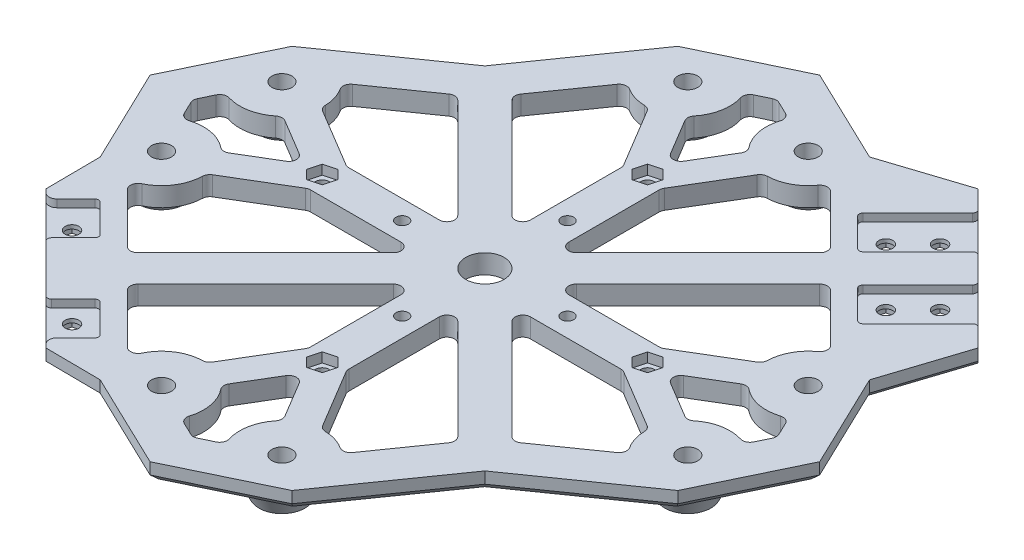
from build123d import *

# Parameters (mm, degrees)
SKETCH1_R           = 2.6
BOSS_EXTRUDE1_DEPTH = 5
CIRPATTERN1_COUNT   = 4
CHAMFER2_SIZE       = 2
SKETCH5_R           = 1.6
CUT_EXTRUDE1_DEPTH  = 124.632678371
CUT_EXTRUDE2_DEPTH  = 2.5
SKETCH8_R           = 1.8
CUT_EXTRUDE3_DEPTH  = 124.858948652
CUT_EXTRUDE4_DEPTH  = 2
CUT_EXTRUDE5_DEPTH  = 2
FILLET1_R           = 1
FILLET2_R           = 2
SKETCH13_R          = 1.8
CUT_EXTRUDE7_DEPTH  = 124.858948652
CUT_EXTRUDE8_DEPTH  = 2.5
SKETCH15_R          = 5
CUT_EXTRUDE9_DEPTH  = 124.858948652


with BuildPart() as part:
    # Sketch1 → Boss-Extrude1 (new body)
    with BuildSketch(Plane(origin=(0, 0, 0), x_dir=(1, 0, 0), z_dir=(0, 1, 0))):
        Polygon((-25.000397559, 75.352774368), (0, 87.349983289), (25.000397559, 75.352774368), (46.347249987, 82.303629811), (82.303629811, 46.347249987), (75.352774368, 25.000397559), (87.349983289, 0), (75.352774368, -25.000397559), (45.752697693, -45.752697693), (25.000397559, -75.352774368), (0, -87.349983289), (-25.000397559, -75.352774368), (-39.269463863, -75.225843687), (-75.225843687, -39.269463863), (-75.352774368, -25.000397559), (-87.349983289, 0), (-75.352774368, 25.000397559), (-45.752697693, 45.752697693), align=None)
        with Locations((-15.705, 68.65)):
            Circle(SKETCH1_R, mode=Mode.SUBTRACT)
        with Locations((15.705, 68.65)):
            Circle(SKETCH1_R, mode=Mode.SUBTRACT)
        with Locations((68.65, 15.705)):
            Circle(SKETCH1_R, mode=Mode.SUBTRACT)
        with Locations((68.65, -15.705)):
            Circle(SKETCH1_R, mode=Mode.SUBTRACT)
        with Locations((15.705, -68.65)):
            Circle(SKETCH1_R, mode=Mode.SUBTRACT)
        with Locations((-15.705, -68.65)):
            Circle(SKETCH1_R, mode=Mode.SUBTRACT)
        with Locations((-68.65, -15.705)):
            Circle(SKETCH1_R, mode=Mode.SUBTRACT)
        with Locations((-68.65, 15.705)):
            Circle(SKETCH1_R, mode=Mode.SUBTRACT)
    extrude(amount=BOSS_EXTRUDE1_DEPTH)

    # Sketch4 → Revolve1 (revolve)
    with BuildSketch(Plane(origin=(14.012041645, 0, -6.724108712), x_dir=(0, -1, 0), z_dir=(0.901565003925945, 0, -0.432643668272183))):
        Polygon((0, 73.18710633), (4, 73.18710633), (4, 74.68710633), (0, 76.68710633), align=None)
    revolve1 = revolve(axis=Axis((-15.705, 5, -68.65), (0, -1, 0)))

    # Mirror1: Revolve1 across plane
    add(revolve1.mirror(Plane(origin=(0, 0, 0), x_dir=(0, 0, 1), z_dir=(1, 0, 0))))

    # CirPattern1: Revolve1 ×4 about axis
    cirpattern1_axis = Axis((0, 0, 0), (0, -1, 0))
    for i in range(1, CIRPATTERN1_COUNT):
        add(revolve1.rotate(cirpattern1_axis, i * 360 / CIRPATTERN1_COUNT))

    # CirPattern1 copy 1 sketch → CirPattern1 copy 1 (revolve)
    with BuildSketch(Plane(origin=(6.724108712, 0, -14.012041645), x_dir=(0, -1, 0), z_dir=(0.4326436682721619, 0, -0.9015650039259551))):
        Polygon((0, -73.18710633), (4, -73.18710633), (4, -74.68710633), (0, -76.68710633), align=None)
    revolve(axis=Axis((68.65, 5, 15.705), (0, 1, 0)))

    # CirPattern1 copy 2 sketch → CirPattern1 copy 2 (revolve)
    with BuildSketch(Plane(origin=(14.012041645, 0, 6.724108712), x_dir=(0, -1, 0), z_dir=(0.9015650039259551, 0, 0.43264366827216183))):
        Polygon((0, -73.18710633), (4, -73.18710633), (4, -74.68710633), (0, -76.68710633), align=None)
    revolve(axis=Axis((-15.705, 5, 68.65), (0, 1, 0)))

    # CirPattern1 copy 3 sketch → CirPattern1 copy 3 (revolve)
    with BuildSketch(Plane(origin=(-6.724108712, 0, 14.012041645), x_dir=(0, -1, 0), z_dir=(-0.4326436682721618, 0, 0.9015650039259552))):
        Polygon((0, -73.18710633), (4, -73.18710633), (4, -74.68710633), (0, -76.68710633), align=None)
    revolve(axis=Axis((-68.65, 5, -15.705), (0, 1, 0)))

    # Chamfer2
    chamfer2_edges = [part.edges().sort_by_distance(p)[0] for p in [
        (-32.134930711, 0, 75.289309027),
        (-12.500198779, 0, 81.351378828),
        (12.500198779, 0, 81.351378828),
        (35.376547626, 0, 60.55273603),
        (60.55273603, 0, 35.376547626),
        (81.351378828, 0, 12.500198779),
        (81.351378828, 0, -12.500198779),
        (78.828202089, 0, -35.673823773),
        (35.673823773, 0, -78.828202089),
        (12.500198779, 0, -81.351378828),
        (-12.500198779, 0, -81.351378828),
        (-35.376547626, 0, -60.55273603),
        (-60.55273603, 0, -35.376547626),
        (-81.351378828, 0, -12.500198779),
        (-81.351378828, 0, 12.500198779),
        (-75.289309027, 0, 32.134930711),
    ]]
    chamfer(chamfer2_edges, length=CHAMFER2_SIZE)

    # Sketch5 → Cut-Extrude1 (cut, through all)
    with BuildSketch(Plane.XZ):
        with Locations((0, 21.566756826)):
            Circle(SKETCH5_R)
        with Locations((-21.566756826, 0)):
            Circle(SKETCH5_R)
        with Locations((0, -21.566756826)):
            Circle(SKETCH5_R)
        with Locations((21.566756826, 0)):
            Circle(SKETCH5_R)
    extrude(amount=-CUT_EXTRUDE1_DEPTH, mode=Mode.SUBTRACT)

    # Sketch6 → Cut-Extrude2 (cut)
    with BuildSketch(Plane.XZ):
        Polygon((2.041241452, 23.607998279), (-0.747146227, 24.355144505), (-2.788387679, 22.313903053), (-2.041241452, 19.525515374), (0.747146227, 18.778369147), (2.788387679, 20.819610599), align=None)
        Polygon((23.607998279, 2.041241452), (20.819610599, 2.788387679), (18.778369147, 0.747146227), (19.525515374, -2.041241452), (22.313903053, -2.788387679), (24.355144505, -0.747146227), align=None)
        Polygon((-19.525515374, 2.041241452), (-22.313903053, 2.788387679), (-24.355144505, 0.747146227), (-23.607998279, -2.041241452), (-20.819610599, -2.788387679), (-18.778369147, -0.747146227), align=None)
        Polygon((-0.747146227, -18.778369147), (-2.788387679, -20.819610599), (-2.041241452, -23.607998279), (0.747146227, -24.355144505), (2.788387679, -22.313903053), (2.041241452, -19.525515374), align=None)
    extrude(amount=-CUT_EXTRUDE2_DEPTH, mode=Mode.SUBTRACT)

    # Sketch8 → Cut-Extrude3 (cut, through all)
    with BuildSketch(Plane(origin=(0, 5, 0), x_dir=(1, 0, 0), z_dir=(0, 1, 0))):
        with Locations((-64.460142943, -43.246939508)):
            Circle(SKETCH8_R)
        with Locations((-43.246939508, -64.460142943)):
            Circle(SKETCH8_R)
        with Locations((51.951071228, 66.800313633)):
            Circle(SKETCH8_R)
        with Locations((44.880003416, 59.729245821)):
            Circle(SKETCH8_R)
        with Locations((66.800313633, 51.951071228)):
            Circle(SKETCH8_R)
        with Locations((59.729245821, 44.880003416)):
            Circle(SKETCH8_R)
    extrude(amount=-CUT_EXTRUDE3_DEPTH, mode=Mode.SUBTRACT)

    # Sketch9 → Cut-Extrude4 (cut)
    with BuildSketch(Plane(origin=(0, 5, 0), x_dir=(1, 0, 0), z_dir=(0, 1, 0))):
        Polygon((-72.945424317, -41.549883233), (-65.874356506, -34.478815421), (-57.106232419, -43.246939508), (-64.177300231, -50.318007319), align=None)
        Polygon((-50.318007319, -64.177300231), (-43.246939508, -57.106232419), (-34.478815421, -65.874356506), (-41.549883233, -72.945424317), align=None)
        Polygon((51.809649872, 76.841229926), (36.11187933, 61.143459384), (44.880003416, 52.375335297), (60.577773959, 68.073105839), align=None)
        Polygon((68.073105839, 60.577773959), (52.375335297, 44.880003416), (61.143459384, 36.11187933), (76.841229926, 51.809649872), align=None)
    extrude(amount=-CUT_EXTRUDE4_DEPTH, mode=Mode.SUBTRACT)

    # Sketch11 → Cut-Extrude5 (cut)
    with BuildSketch(Plane.XZ):
        Polygon((-40.899511837, 66.807570613), (-44.106157668, 67.666788774), (-46.453585339, 65.319361104), (-45.594367178, 62.112715273), (-42.387721347, 61.253497112), (-40.040293677, 63.600924782), align=None)
        Polygon((-65.319361104, 46.453585339), (-67.666788774, 44.106157668), (-66.807570613, 40.899511837), (-63.600924782, 40.040293677), (-61.253497112, 42.387721347), (-62.112715273, 45.594367178), align=None)
        Polygon((62.076673492, -42.532575746), (58.870027661, -41.673357585), (56.52259999, -44.020785256), (57.381818151, -47.227431087), (60.588463982, -48.086649247), (62.935891652, -45.739221577), align=None)
        Polygon((69.147741303, -49.603643558), (65.941095472, -48.744425397), (63.593667802, -51.091853068), (64.452885963, -54.298498899), (67.659531794, -55.157717059), (70.006959464, -52.810289389), align=None)
        Polygon((54.298498899, -64.452885963), (51.091853068, -63.593667802), (48.744425397, -65.941095472), (49.603643558, -69.147741303), (52.810289389, -70.006959464), (55.157717059, -67.659531794), align=None)
        Polygon((47.227431087, -57.381818151), (44.020785256, -56.52259999), (41.673357585, -58.870027661), (42.532575746, -62.076673492), (45.739221577, -62.935891652), (48.086649247, -60.588463982), align=None)
    extrude(amount=-CUT_EXTRUDE5_DEPTH, mode=Mode.SUBTRACT)

    # Fillet1
    fillet1_edges = [part.edges().sort_by_distance(p)[0] for p in [
        (-43.246939508, 4, 57.106232419),
        (-50.318007319, 4, 64.177300231),
        (-34.478815421, 4, 65.874356506),
        (-57.106232419, 4, 43.246939508),
        (-64.177300231, 4, 50.318007319),
        (-65.874356506, 4, 34.478815421),
        (60.577773959, 4, -68.073105839),
        (44.880003416, 4, -52.375335297),
        (76.841229926, 4, -51.809649872),
        (61.143459384, 4, -36.11187933),
        (68.073105839, 4, -60.577773959),
        (52.375335297, 4, -44.880003416),
        (51.809649872, 4, -76.841229926),
        (36.11187933, 4, -61.143459384),
    ]]
    fillet(fillet1_edges, radius=FILLET1_R)

    # Fillet2
    fillet2_edges = [part.edges().sort_by_distance(p)[0] for p in [
        (-41.549883233, 4, 72.945424317),
        (-72.945424317, 4, 41.549883233),
    ]]
    fillet(fillet2_edges, radius=FILLET2_R)

    # Sketch13 → Cut-Extrude7 (cut, through all)
    with BuildSketch(Plane(origin=(0, 5, 0), x_dir=(1, 0, 0), z_dir=(0, 1, 0))):
        with Locations((0, 42.426406871)):
            Circle(SKETCH13_R)
        with Locations((42.426406871, 0)):
            Circle(SKETCH13_R)
        with Locations((0, -42.426406871)):
            Circle(SKETCH13_R)
        with Locations((-42.426406871, 0)):
            Circle(SKETCH13_R)
    extrude(amount=-CUT_EXTRUDE7_DEPTH, mode=Mode.SUBTRACT)

    # Sketch14 → Cut-Extrude8 (cut)
    with BuildSketch(Plane(origin=(0, 5, 0), x_dir=(1, 0, 0), z_dir=(0, 1, 0))):
        Polygon((3.206645831, 43.285625032), (0.859218161, 45.633052702), (-2.34742767, 44.773834541), (-3.206645831, 41.56718871), (-0.859218161, 39.21976104), (2.34742767, 40.078979201), align=None)
        Polygon((43.285625032, 3.206645831), (40.078979201, 2.34742767), (39.21976104, -0.859218161), (41.56718871, -3.206645831), (44.773834541, -2.34742767), (45.633052702, 0.859218161), align=None)
        Polygon((0.859218161, -39.21976104), (-2.34742767, -40.078979201), (-3.206645831, -43.285625032), (-0.859218161, -45.633052702), (2.34742767, -44.773834541), (3.206645831, -41.56718871), align=None)
        Polygon((-39.21976104, 0.859218161), (-41.56718871, 3.206645831), (-44.773834541, 2.34742767), (-45.633052702, -0.859218161), (-43.285625032, -3.206645831), (-40.078979201, -2.34742767), align=None)
    extrude(amount=-CUT_EXTRUDE8_DEPTH, mode=Mode.SUBTRACT)

    # Sketch15 → Cut-Extrude9 (cut, through all)
    with BuildSketch(Plane(origin=(0, 5, 0), x_dir=(1, 0, 0), z_dir=(0, 1, 0))):
        Circle(SKETCH15_R)
        with BuildLine():
            Line((-58.852206169, 24.355964891), (-44.105038963, 34.695047569))
            ThreePointArc((-44.105038963, 34.695047569), (-42.783195007, 35.049863165), (-41.542703678, 34.471635866))
            Line((-41.542703678, 34.471635866), (-15.485281374, 8.414213562))
            ThreePointArc((-15.485281374, 8.414213562), (-15.051735872, 6.234633135), (-16.899494937, 5))
            Line((-16.899494937, 5), (-40.490601096, 5))
            ThreePointArc((-40.490601096, 5), (-41.023679978, 5.072351976), (-41.51818955, 5.284173095))
            Line((-41.51818955, 5.284173095), (-56.683057857, 14.366233497))
            ThreePointArc((-56.683057857, 14.366233497), (-57.380980681, 15.070818182), (-57.654627956, 16.024051109))
            ThreePointArc((-57.654627956, 16.024051109), (-58.139410466, 18.949612097), (-59.388071455, 21.639364299))
            ThreePointArc((-59.388071455, 21.639364299), (-59.666274463, 23.105393032), (-58.852206169, 24.355964891))
        make_face()
        with BuildLine():
            Line((-74.269911641, 4.143212944), (-75.84292496, 0.865287337))
            ThreePointArc((-75.84292496, 0.865287337), (-76.039794952, 0), (-75.84292496, -0.865287337))
            Line((-75.84292496, -0.865287337), (-74.269911641, -4.143212944))
            ThreePointArc((-74.269911641, -4.143212944), (-73.268935292, -5.110014444), (-71.879584459, -5.189783206))
            ThreePointArc((-71.879584459, -5.189783206), (-66.573971622, -4.902680519), (-61.752741768, -7.135996039))
            ThreePointArc((-61.752741768, -7.135996039), (-60.636709812, -7.573227602), (-59.471106362, -7.293822224))
            Line((-59.471106362, -7.293822224), (-50.157188519, -1.715826905))
            ThreePointArc((-50.157188519, -1.715826905), (-49.184776974, 0), (-50.157188519, 1.715826905))
            Line((-50.157188519, 1.715826905), (-59.471106362, 7.293822224))
            ThreePointArc((-59.471106362, 7.293822224), (-60.636709812, 7.573227602), (-61.752741768, 7.135996039))
            ThreePointArc((-61.752741768, 7.135996039), (-66.573971622, 4.902680519), (-71.879584459, 5.189783206))
            ThreePointArc((-71.879584459, 5.189783206), (-73.268935292, 5.110014444), (-74.269911641, 4.143212944))
        make_face()
        with BuildLine():
            Line((-34.695047569, 44.105038963), (-24.355964891, 58.852206169))
            ThreePointArc((-24.355964891, 58.852206169), (-23.105393032, 59.666274463), (-21.639364299, 59.388071455))
            ThreePointArc((-21.639364299, 59.388071455), (-18.949612097, 58.139410466), (-16.024051109, 57.654627956))
            ThreePointArc((-16.024051109, 57.654627956), (-15.070818182, 57.380980681), (-14.366233497, 56.683057857))
            Line((-14.366233497, 56.683057857), (-5.284173095, 41.51818955))
            ThreePointArc((-5.284173095, 41.51818955), (-5.072351976, 41.023679978), (-5, 40.490601096))
            Line((-5, 40.490601096), (-5, 16.899494937))
            ThreePointArc((-5, 16.899494937), (-6.234633135, 15.051735872), (-8.414213562, 15.485281374))
            Line((-8.414213562, 15.485281374), (-34.471635866, 41.542703678))
            ThreePointArc((-34.471635866, 41.542703678), (-35.049863165, 42.783195007), (-34.695047569, 44.105038963))
        make_face()
        with BuildLine():
            Line((-4.143212944, 74.269911641), (-0.865287337, 75.84292496))
            ThreePointArc((-0.865287337, 75.84292496), (0, 76.039794952), (0.865287337, 75.84292496))
            Line((0.865287337, 75.84292496), (4.143212944, 74.269911641))
            ThreePointArc((4.143212944, 74.269911641), (5.110014444, 73.268935292), (5.189783206, 71.879584459))
            ThreePointArc((5.189783206, 71.879584459), (4.902680519, 66.573971622), (7.135996039, 61.752741768))
            ThreePointArc((7.135996039, 61.752741768), (7.573227602, 60.636709812), (7.293822224, 59.471106362))
            Line((7.293822224, 59.471106362), (1.715826905, 50.157188519))
            ThreePointArc((1.715826905, 50.157188519), (0, 49.184776974), (-1.715826905, 50.157188519))
            Line((-1.715826905, 50.157188519), (-7.293822224, 59.471106362))
            ThreePointArc((-7.293822224, 59.471106362), (-7.573227602, 60.636709812), (-7.135996039, 61.752741768))
            ThreePointArc((-7.135996039, 61.752741768), (-4.902680519, 66.573971622), (-5.189783206, 71.879584459))
            ThreePointArc((-5.189783206, 71.879584459), (-5.110014444, 73.268935292), (-4.143212944, 74.269911641))
        make_face()
        with BuildLine():
            Line((-56.683057857, -14.366233497), (-41.51818955, -5.284173095))
            ThreePointArc((-41.51818955, -5.284173095), (-41.023679978, -5.072351976), (-40.490601096, -5))
            Line((-40.490601096, -5), (-16.899494937, -5))
            ThreePointArc((-16.899494937, -5), (-15.051735872, -6.234633135), (-15.485281374, -8.414213562))
            Line((-15.485281374, -8.414213562), (-48.762372401, -41.691304589))
            ThreePointArc((-48.762372401, -41.691304589), (-50.176585963, -42.277091027), (-51.590799526, -41.691304589))
            Line((-51.590799526, -41.691304589), (-64.441670212, -28.840433903))
            ThreePointArc((-64.441670212, -28.840433903), (-64.998941561, -27.089698063), (-63.892463319, -25.622955673))
            ThreePointArc((-63.892463319, -25.622955673), (-59.426482475, -21.698890595), (-57.654627956, -16.024051109))
            ThreePointArc((-57.654627956, -16.024051109), (-57.380980681, -15.070818182), (-56.683057857, -14.366233497))
        make_face()
        with BuildLine():
            Line((5, 40.490601096), (5, 16.899494937))
            ThreePointArc((5, 16.899494937), (6.234633135, 15.051735872), (8.414213562, 15.485281374))
            Line((8.414213562, 15.485281374), (40.142387983, 47.213455794))
            ThreePointArc((40.142387983, 47.213455794), (40.72817442, 48.627669357), (40.142387983, 50.041882919))
            Line((40.142387983, 50.041882919), (27.688744236, 62.495526666))
            ThreePointArc((27.688744236, 62.495526666), (26.110756271, 63.074596311), (24.648449032, 62.245726472))
            ThreePointArc((24.648449032, 62.245726472), (20.873948018, 58.940109352), (16.024051109, 57.654627956))
            ThreePointArc((16.024051109, 57.654627956), (15.070818182, 57.380980681), (14.366233497, 56.683057857))
            Line((14.366233497, 56.683057857), (5.284173095, 41.51818955))
            ThreePointArc((5.284173095, 41.51818955), (5.072351976, 41.023679978), (5, 40.490601096))
        make_face()
        with BuildLine():
            Line((40.490601096, 5), (16.899494937, 5))
            ThreePointArc((16.899494937, 5), (15.051735872, 6.234633135), (15.485281374, 8.414213562))
            Line((15.485281374, 8.414213562), (47.213455794, 40.142387983))
            ThreePointArc((47.213455794, 40.142387983), (48.627669357, 40.72817442), (50.041882919, 40.142387983))
            Line((50.041882919, 40.142387983), (62.495526666, 27.688744236))
            ThreePointArc((62.495526666, 27.688744236), (63.074596311, 26.110756271), (62.245726472, 24.648449032))
            ThreePointArc((62.245726472, 24.648449032), (58.940109352, 20.873948018), (57.654627956, 16.024051109))
            ThreePointArc((57.654627956, 16.024051109), (57.380980681, 15.070818182), (56.683057857, 14.366233497))
            Line((56.683057857, 14.366233497), (41.51818955, 5.284173095))
            ThreePointArc((41.51818955, 5.284173095), (41.023679978, 5.072351976), (40.490601096, 5))
        make_face()
        with BuildLine():
            Line((59.471106362, -7.293822224), (50.157188519, -1.715826905))
            ThreePointArc((50.157188519, -1.715826905), (49.184776974, 0), (50.157188519, 1.715826905))
            Line((50.157188519, 1.715826905), (59.471106362, 7.293822224))
            ThreePointArc((59.471106362, 7.293822224), (60.636709812, 7.573227602), (61.752741768, 7.135996039))
            ThreePointArc((61.752741768, 7.135996039), (66.573971622, 4.902680519), (71.879584459, 5.189783206))
            ThreePointArc((71.879584459, 5.189783206), (73.268935292, 5.110014444), (74.269911641, 4.143212944))
            Line((74.269911641, 4.143212944), (75.84292496, 0.865287337))
            ThreePointArc((75.84292496, 0.865287337), (76.039794952, 0), (75.84292496, -0.865287337))
            Line((75.84292496, -0.865287337), (74.269911641, -4.143212944))
            ThreePointArc((74.269911641, -4.143212944), (73.268935292, -5.110014444), (71.879584459, -5.189783206))
            ThreePointArc((71.879584459, -5.189783206), (66.573971622, -4.902680519), (61.752741768, -7.135996039))
            ThreePointArc((61.752741768, -7.135996039), (60.636709812, -7.573227602), (59.471106362, -7.293822224))
        make_face()
        with BuildLine():
            Line((44.105038963, -34.695047569), (58.852206169, -24.355964891))
            ThreePointArc((58.852206169, -24.355964891), (59.666274463, -23.105393032), (59.388071455, -21.639364299))
            ThreePointArc((59.388071455, -21.639364299), (58.139410466, -18.949612097), (57.654627956, -16.024051109))
            ThreePointArc((57.654627956, -16.024051109), (57.380980681, -15.070818182), (56.683057857, -14.366233497))
            Line((56.683057857, -14.366233497), (41.51818955, -5.284173095))
            ThreePointArc((41.51818955, -5.284173095), (41.023679978, -5.072351976), (40.490601096, -5))
            Line((40.490601096, -5), (16.899494937, -5))
            ThreePointArc((16.899494937, -5), (15.051735872, -6.234633135), (15.485281374, -8.414213562))
            Line((15.485281374, -8.414213562), (41.542703678, -34.471635866))
            ThreePointArc((41.542703678, -34.471635866), (42.783195007, -35.049863165), (44.105038963, -34.695047569))
        make_face()
        with BuildLine():
            Line((24.355964891, -58.852206169), (34.695047569, -44.105038963))
            ThreePointArc((34.695047569, -44.105038963), (35.049863165, -42.783195007), (34.471635866, -41.542703678))
            Line((34.471635866, -41.542703678), (8.414213562, -15.485281374))
            ThreePointArc((8.414213562, -15.485281374), (6.234633135, -15.051735872), (5, -16.899494937))
            Line((5, -16.899494937), (5, -40.490601096))
            ThreePointArc((5, -40.490601096), (5.072351976, -41.023679978), (5.284173095, -41.51818955))
            Line((5.284173095, -41.51818955), (14.366233497, -56.683057857))
            ThreePointArc((14.366233497, -56.683057857), (15.070818182, -57.380980681), (16.024051109, -57.654627956))
            ThreePointArc((16.024051109, -57.654627956), (18.949612097, -58.139410466), (21.639364299, -59.388071455))
            ThreePointArc((21.639364299, -59.388071455), (23.105393032, -59.666274463), (24.355964891, -58.852206169))
        make_face()
        with BuildLine():
            Line((7.293822224, -59.471106362), (1.715826905, -50.157188519))
            ThreePointArc((1.715826905, -50.157188519), (0, -49.184776974), (-1.715826905, -50.157188519))
            Line((-1.715826905, -50.157188519), (-7.293822224, -59.471106362))
            ThreePointArc((-7.293822224, -59.471106362), (-7.573227602, -60.636709812), (-7.135996039, -61.752741768))
            ThreePointArc((-7.135996039, -61.752741768), (-4.902680519, -66.573971622), (-5.189783206, -71.879584459))
            ThreePointArc((-5.189783206, -71.879584459), (-5.110014444, -73.268935292), (-4.143212944, -74.269911641))
            Line((-4.143212944, -74.269911641), (-0.865287337, -75.84292496))
            ThreePointArc((-0.865287337, -75.84292496), (0, -76.039794952), (0.865287337, -75.84292496))
            Line((0.865287337, -75.84292496), (4.143212944, -74.269911641))
            ThreePointArc((4.143212944, -74.269911641), (5.110014444, -73.268935292), (5.189783206, -71.879584459))
            ThreePointArc((5.189783206, -71.879584459), (4.902680519, -66.573971622), (7.135996039, -61.752741768))
            ThreePointArc((7.135996039, -61.752741768), (7.573227602, -60.636709812), (7.293822224, -59.471106362))
        make_face()
        with BuildLine():
            Line((-41.691304589, -51.590799526), (-28.840433903, -64.441670212))
            ThreePointArc((-28.840433903, -64.441670212), (-27.089698063, -64.998941561), (-25.622955673, -63.892463319))
            ThreePointArc((-25.622955673, -63.892463319), (-21.698890595, -59.426482475), (-16.024051109, -57.654627956))
            ThreePointArc((-16.024051109, -57.654627956), (-15.070818182, -57.380980681), (-14.366233497, -56.683057857))
            Line((-14.366233497, -56.683057857), (-5.284173095, -41.51818955))
            ThreePointArc((-5.284173095, -41.51818955), (-5.072351976, -41.023679978), (-5, -40.490601096))
            Line((-5, -40.490601096), (-5, -16.899494937))
            ThreePointArc((-5, -16.899494937), (-6.234633135, -15.051735872), (-8.414213562, -15.485281374))
            Line((-8.414213562, -15.485281374), (-41.691304589, -48.762372401))
            ThreePointArc((-41.691304589, -48.762372401), (-42.277091027, -50.176585963), (-41.691304589, -51.590799526))
        make_face()
    extrude(amount=-CUT_EXTRUDE9_DEPTH, mode=Mode.SUBTRACT)


solid = part.part
